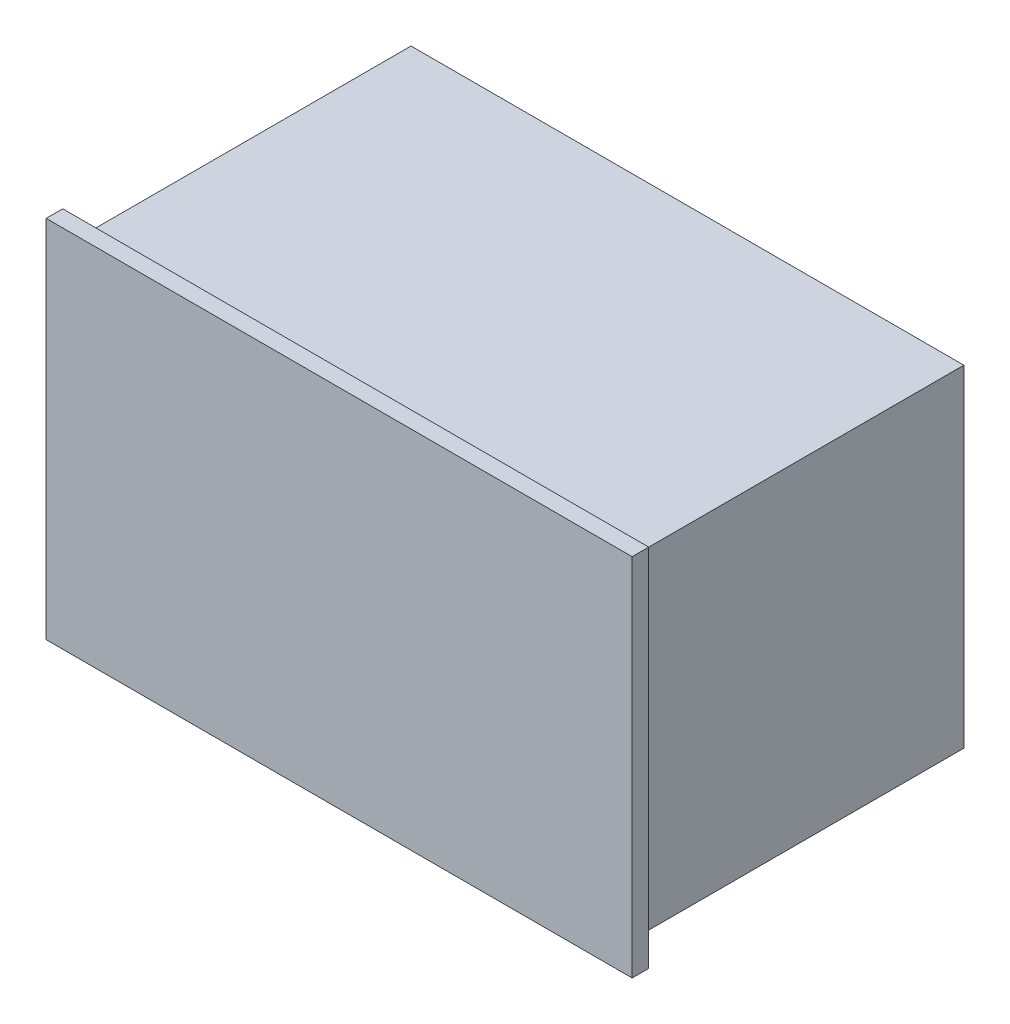
from build123d import *

# Parameters (mm, degrees)
SKETCH_1_W          = 100
SKETCH_1_H          = 60
EXTRUDE_1_DEPTH     = 60
SKETCH_2_W          = 94
SKETCH_2_H          = 54
CUT_EXTRUDE_1_DEPTH = 57
CUT_EXTRUDE_2_REACH = 133.149
SKETCH_8_R          = 5.5
SKETCH_9_W          = 106
SKETCH_9_H          = 66
EXTRUDE_2_DEPTH     = 3


with BuildPart() as part:
    # 草图1 → 凸台-拉伸1 (new body)
    with BuildSketch(Plane.XY):
        with Locations((50, 30)):
            Rectangle(SKETCH_1_W, SKETCH_1_H)
    extrude(amount=EXTRUDE_1_DEPTH)

    # 草图2 → 切除-拉伸1 (cut)
    with BuildSketch(Plane.XY.offset(60)):
        with Locations((50, 30)):
            Rectangle(SKETCH_2_W, SKETCH_2_H)
    extrude(amount=-CUT_EXTRUDE_1_DEPTH, mode=Mode.SUBTRACT)

    # 草图8 → 切除-拉伸2 (cut, up to next)
    with BuildSketch(Plane.XZ, mode=Mode.PRIVATE) as cut_extrude_2_sk1:
        with Locations(Location((15, 12, 0), (0, 0, 270))):
            Circle(SKETCH_8_R)
    cut_extrude_2_tool1 = extrude(cut_extrude_2_sk1.sketch, amount=-CUT_EXTRUDE_2_REACH, mode=Mode.PRIVATE) & part.part
    # 草图8 → 切除-拉伸2 (cut, up to next)
    with BuildSketch(Plane.XZ, mode=Mode.PRIVATE) as cut_extrude_2_sk2:
        with Locations(Location((30, 12, 0), (0, 0, 270))):
            Circle(SKETCH_8_R)
    cut_extrude_2_tool2 = extrude(cut_extrude_2_sk2.sketch, amount=-CUT_EXTRUDE_2_REACH, mode=Mode.PRIVATE) & part.part
    add(cut_extrude_2_tool1.solids().sort_by_distance((15, 0, 12))[0], mode=Mode.SUBTRACT)
    add(cut_extrude_2_tool2.solids().sort_by_distance((30, 0, 12))[0], mode=Mode.SUBTRACT)

    # 草图9 → 凸台-拉伸2 (add)
    with BuildSketch(Plane.XY.offset(60)):
        with Locations((50, 30)):
            Rectangle(SKETCH_9_W, SKETCH_9_H)
    extrude(amount=EXTRUDE_2_DEPTH)


solid = part.part
